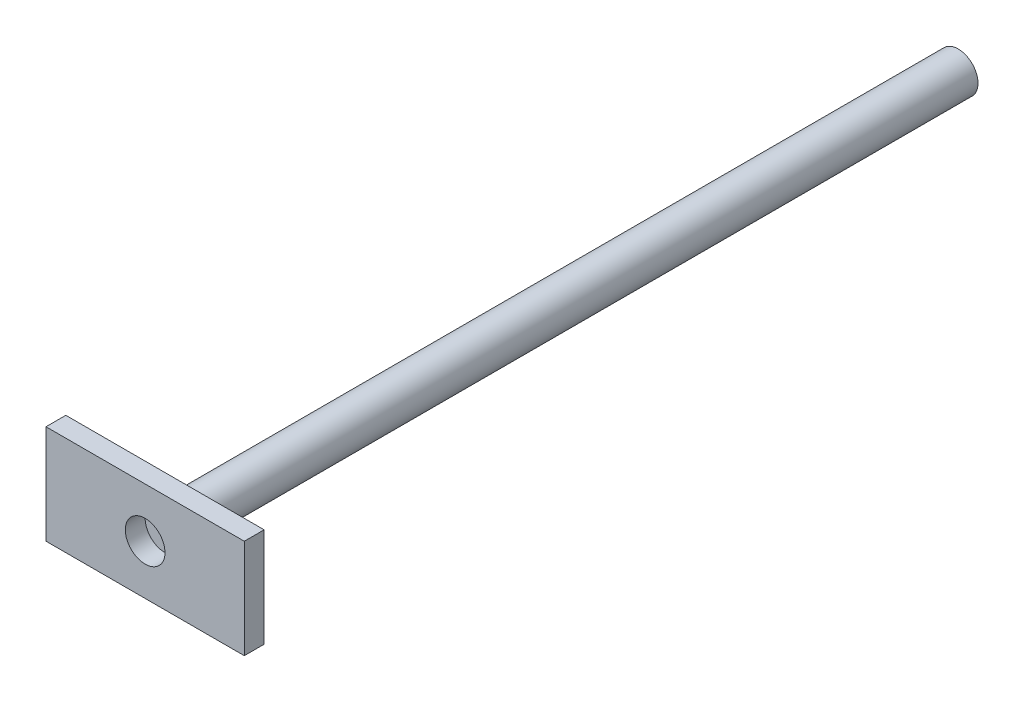
from build123d import *

# Parameters (mm, degrees)
SKETCH_1_R      = 10
EXTRUDE_1_DEPTH = 400
SKETCH_2_W      = 100
SKETCH_2_H      = 50
SKETCH_2_R      = 10
EXTRUDE_2_DEPTH = 10


with BuildPart() as part:
    # 草图1 → 凸台-拉伸1 (new body)
    with BuildSketch(Plane.XY):
        Circle(SKETCH_1_R)
    extrude(amount=EXTRUDE_1_DEPTH)


with BuildPart() as body_2:
    # 草图2 → 凸台-拉伸2 (new body)
    with BuildSketch(Plane.XY.offset(400)):
        Rectangle(SKETCH_2_W, SKETCH_2_H)
        Circle(SKETCH_2_R, mode=Mode.SUBTRACT)
    extrude(amount=EXTRUDE_2_DEPTH)


solid = Compound([part.part, body_2.part])
